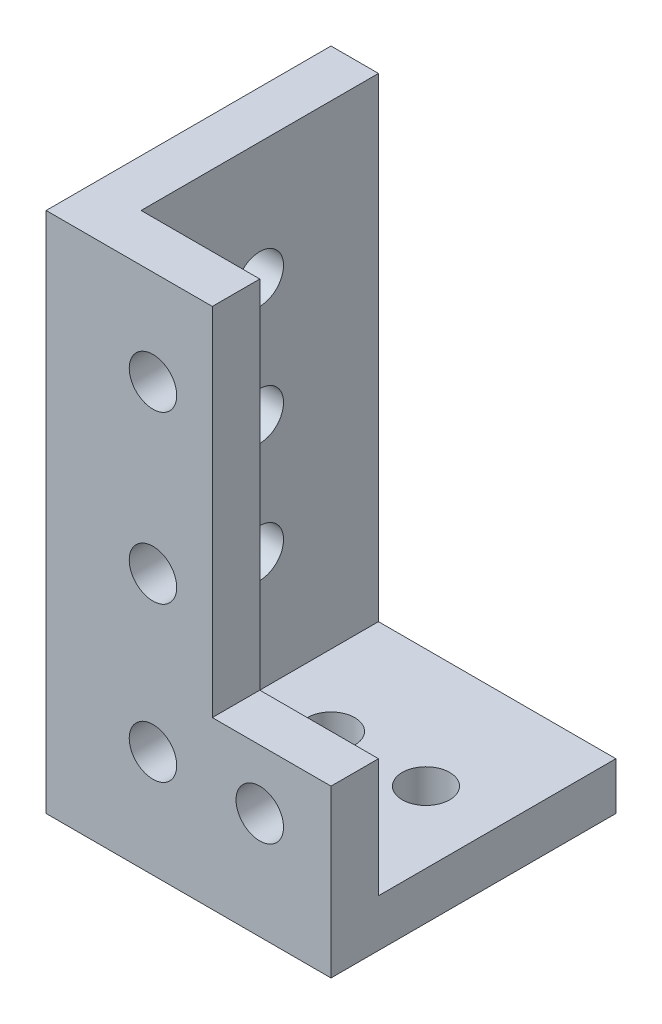
from build123d import *

# Parameters (mm, degrees)
BOSS_EXTRUDE1_DEPTH = 50
BOSS_EXTRUDE2_DEPTH = 10
SKETCH4_R           = 5
CUT_EXTRUDE1_DEPTH  = 10
SKETCH5_R           = 5
CUT_EXTRUDE2_DEPTH  = 10
SKETCH6_R           = 5
CUT_EXTRUDE3_DEPTH  = 10


with BuildPart() as part:
    # Sketch1 → Boss-Extrude1 (new body)
    with BuildSketch(Plane.XY):
        Polygon((0, 110), (10, 110), (10, 10), (60, 10), (60, 0), (0, 0), align=None)
    extrude(amount=BOSS_EXTRUDE1_DEPTH)

    # Sketch2 → Boss-Extrude2 (add)
    with BuildSketch(Plane.XY.offset(50)):
        Polygon((0, 110), (35, 110), (35, 35), (60, 35), (60, 0), (0, 0), align=None)
    extrude(amount=BOSS_EXTRUDE2_DEPTH)

    # Sketch4 → Cut-Extrude1 (cut)
    with BuildSketch(Plane(origin=(10, 0, 0), x_dir=(0, 0, -1), z_dir=(1, 0, 0))):
        with Locations((-25, 60)):
            Circle(SKETCH4_R)
        with Locations((-25, 85)):
            Circle(SKETCH4_R)
        with Locations((-25, 35)):
            Circle(SKETCH4_R)
    extrude(amount=-CUT_EXTRUDE1_DEPTH, mode=Mode.SUBTRACT)

    # Sketch5 → Cut-Extrude2 (cut)
    with BuildSketch(Plane(origin=(0, 10, 0), x_dir=(1, 0, 0), z_dir=(0, 1, 0))):
        with Locations(Location((45, -25, 0), (0, 0, 270))):
            Circle(SKETCH5_R)
        with Locations(Location((25, -25, 0), (0, 0, 270))):
            Circle(SKETCH5_R)
    extrude(amount=-CUT_EXTRUDE2_DEPTH, mode=Mode.SUBTRACT)

    # Sketch6 → Cut-Extrude3 (cut)
    with BuildSketch(Plane(origin=(0, 0, 50), x_dir=(-1, 0, 0), z_dir=(0, 0, -1))):
        with Locations((-22.5, 22.5)):
            Circle(SKETCH6_R)
        with Locations((-22.5, 55)):
            Circle(SKETCH6_R)
        with Locations((-22.5, 90)):
            Circle(SKETCH6_R)
        with Locations((-45, 22.5)):
            Circle(SKETCH6_R)
    extrude(amount=-CUT_EXTRUDE3_DEPTH, mode=Mode.SUBTRACT)


solid = part.part
